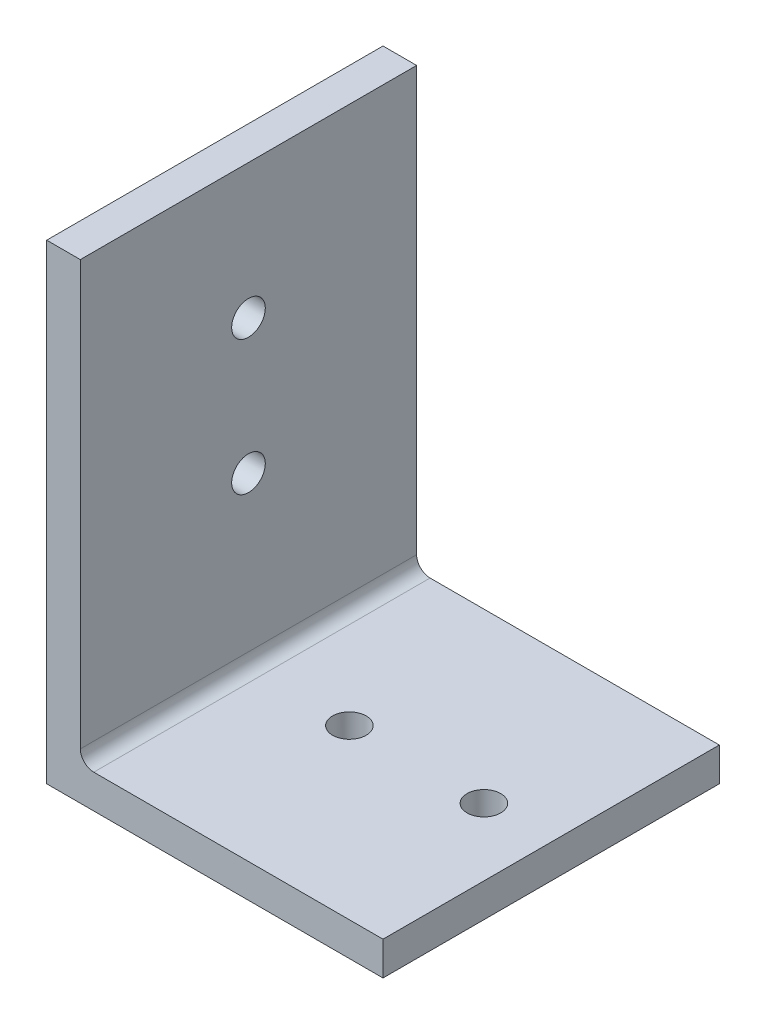
from build123d import *

# Parameters (mm, degrees)
BOSS_EXTRUDE2_DEPTH = 31.75
CUT_EXTRUDE1_REACH  = 115.77
SKETCH2_R           = 3.175
CUT_EXTRUDE2_REACH  = 115.77
SKETCH3_R           = 3.175
FILLET2_R           = 2.54


with BuildPart() as part:
    # Sketch1 → Boss-Extrude2 (new, symmetric)
    with BuildSketch(Plane.XY):
        Polygon((0, 0), (0, 88.9), (6.35, 88.9), (6.35, 6.35), (63.5, 6.35), (63.5, 0), align=None)
    extrude(amount=BOSS_EXTRUDE2_DEPTH, both=True)

    # Sketch2 → Cut-Extrude1 (cut, up to next)
    with BuildSketch(Plane.ZY, mode=Mode.PRIVATE) as cut_extrude1_sk1:
        with Locations((0, 63.5)):
            Circle(SKETCH2_R)
    cut_extrude1_tool1 = extrude(cut_extrude1_sk1.sketch, amount=-CUT_EXTRUDE1_REACH, mode=Mode.PRIVATE) & part.part
    # Sketch2 → Cut-Extrude1 (cut, up to next)
    with BuildSketch(Plane.ZY, mode=Mode.PRIVATE) as cut_extrude1_sk2:
        with Locations((0, 38.1)):
            Circle(SKETCH2_R)
    cut_extrude1_tool2 = extrude(cut_extrude1_sk2.sketch, amount=-CUT_EXTRUDE1_REACH, mode=Mode.PRIVATE) & part.part
    add(cut_extrude1_tool1.solids().sort_by_distance((0, 63.5, 0))[0], mode=Mode.SUBTRACT)
    add(cut_extrude1_tool2.solids().sort_by_distance((0, 38.1, 0))[0], mode=Mode.SUBTRACT)

    # Sketch3 → Cut-Extrude2 (cut, up to next)
    with BuildSketch(Plane.XZ, mode=Mode.PRIVATE) as cut_extrude2_sk1:
        with Locations((25.4, 0)):
            Circle(SKETCH3_R)
    cut_extrude2_tool1 = extrude(cut_extrude2_sk1.sketch, amount=-CUT_EXTRUDE2_REACH, mode=Mode.PRIVATE) & part.part
    # Sketch3 → Cut-Extrude2 (cut, up to next)
    with BuildSketch(Plane.XZ, mode=Mode.PRIVATE) as cut_extrude2_sk2:
        with Locations((50.8, 0)):
            Circle(SKETCH3_R)
    cut_extrude2_tool2 = extrude(cut_extrude2_sk2.sketch, amount=-CUT_EXTRUDE2_REACH, mode=Mode.PRIVATE) & part.part
    add(cut_extrude2_tool1.solids().sort_by_distance((25.4, 0, 0))[0], mode=Mode.SUBTRACT)
    add(cut_extrude2_tool2.solids().sort_by_distance((50.8, 0, 0))[0], mode=Mode.SUBTRACT)

    # Fillet2
    fillet2_edges = [part.edges().sort_by_distance(p)[0] for p in [
        (6.35, 6.35, 0),
    ]]
    fillet(fillet2_edges, radius=FILLET2_R)


solid = part.part
